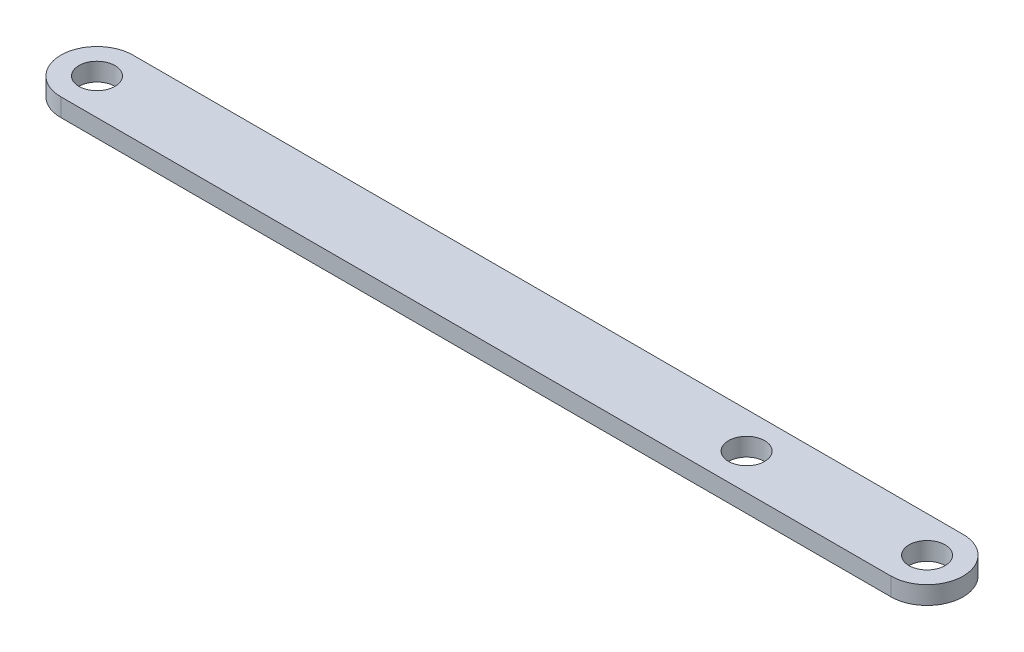
from build123d import *

# Parameters (mm, degrees)
SKETCH1_R           = 5
BOSS_EXTRUDE1_DEPTH = 5
SKETCH2_R           = 5
CUT_EXTRUDE1_DEPTH  = 10


with BuildPart() as part:
    # Sketch1 → Boss-Extrude1 (new body)
    with BuildSketch(Plane(origin=(0, 0, 0), x_dir=(1, 0, 0), z_dir=(0, 1, 0))):
        with BuildLine():
            Line((-72.346809709, 10), (157.653190291, 10))
            ThreePointArc((157.653190291, 10), (167.653190291, 0), (157.653190291, -10))
            Line((157.653190291, -10), (-72.346809709, -10))
            ThreePointArc((-72.346809709, -10), (-82.346809709, 0), (-72.346809709, 10))
        make_face()
        with Locations(Location((-72.346809709, 0, 0), (0, 0, 270))):
            Circle(SKETCH1_R, mode=Mode.SUBTRACT)
        with Locations(Location((157.653190291, 0, 0), (0, 0, 270))):
            Circle(SKETCH1_R, mode=Mode.SUBTRACT)
    extrude(amount=BOSS_EXTRUDE1_DEPTH)

    # Sketch2 → Cut-Extrude1 (cut)
    with BuildSketch(Plane(origin=(0, 5, 0), x_dir=(1, 0, 0), z_dir=(0, 1, 0))):
        with Locations(Location((107.653190291, 0, 0), (0, 0, 270))):
            Circle(SKETCH2_R)
    extrude(amount=-CUT_EXTRUDE1_DEPTH, mode=Mode.SUBTRACT)


solid = part.part
